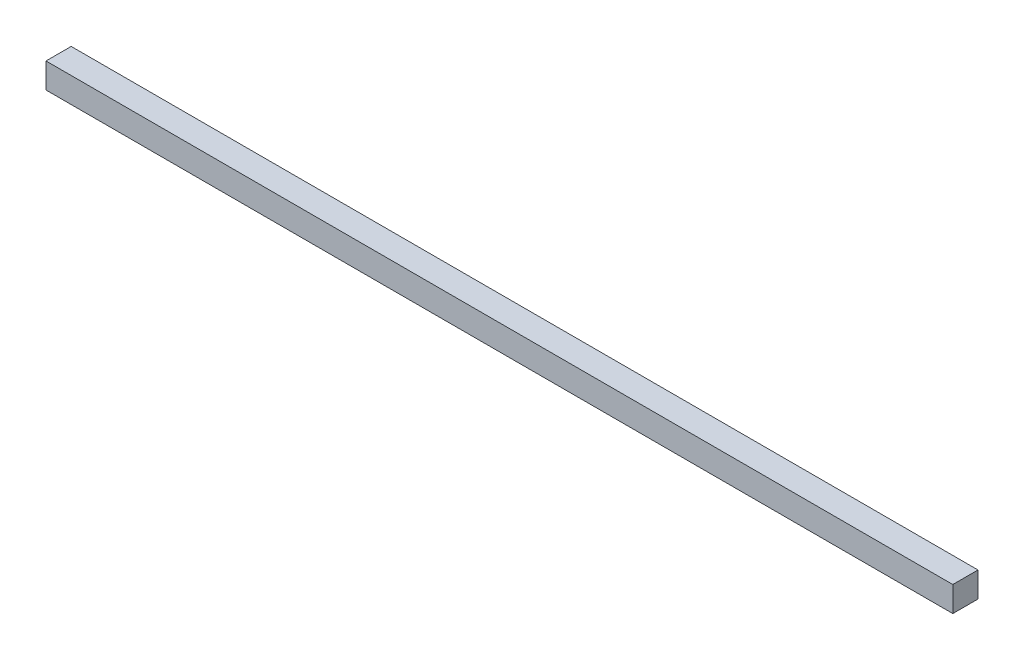
from build123d import *

# Parameters (mm, degrees)
SKETCH1_W           = 9144
SKETCH1_H           = 254
BOSS_EXTRUDE1_DEPTH = 254


with BuildPart() as part:
    # Sketch1 → Boss-Extrude1 (new body)
    with BuildSketch(Plane.XY):
        Rectangle(SKETCH1_W, SKETCH1_H)
    extrude(amount=BOSS_EXTRUDE1_DEPTH)


solid = part.part
